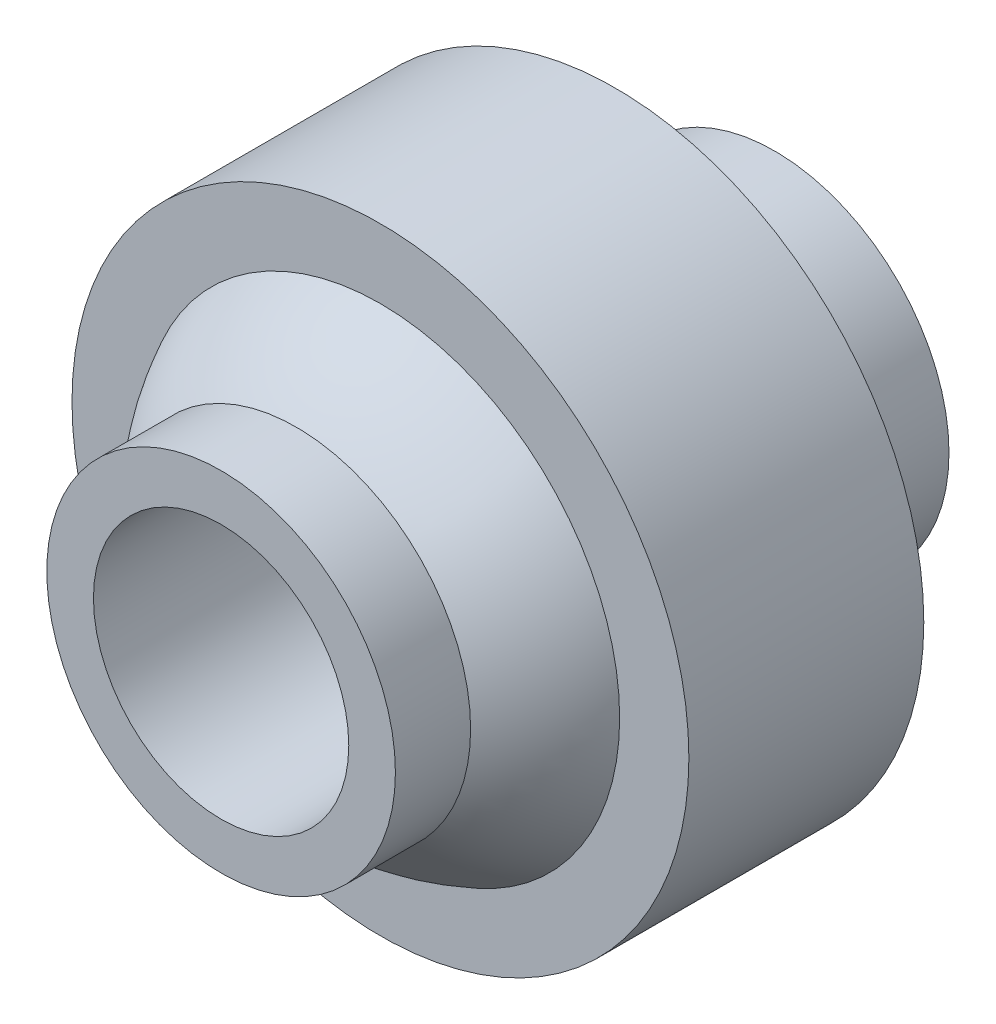
from build123d import *


with BuildPart() as part:
    # Sketch1 → Revolve1 (revolve)
    with BuildSketch(Plane(origin=(0, 0, 0), x_dir=(0, 0, -1), z_dir=(1, 0, 0)), mode=Mode.PRIVATE) as revolve1_sk:
        with BuildLine():
            Line((-10.3251, -4.7625), (10.3251, -4.7625))
            Line((10.3251, -4.7625), (10.3251, -6.5024))
            Line((10.3251, -6.5024), (7.519993039, -6.5024))
            ThreePointArc((7.519993039, -6.5024), (6.0726569, -7.871107878), (4.3815, -8.923786125))
            Line((4.3815, -8.923786125), (4.3815, -11.5062))
            Line((4.3815, -11.5062), (-4.3815, -11.5062))
            Line((-4.3815, -11.5062), (-4.3815, -8.923786125))
            ThreePointArc((-4.3815, -8.923786125), (-6.0726569, -7.871107878), (-7.519993039, -6.5024))
            Line((-7.519993039, -6.5024), (-10.3251, -6.5024))
            Line((-10.3251, -6.5024), (-10.3251, -4.7625))
        make_face()
    revolve(revolve1_sk.sketch.rotate(Axis((0, 0, 0), (0, 0, -1)), 270), axis=Axis((0, 0, 0), (0, 0, -1)))


solid = part.part
